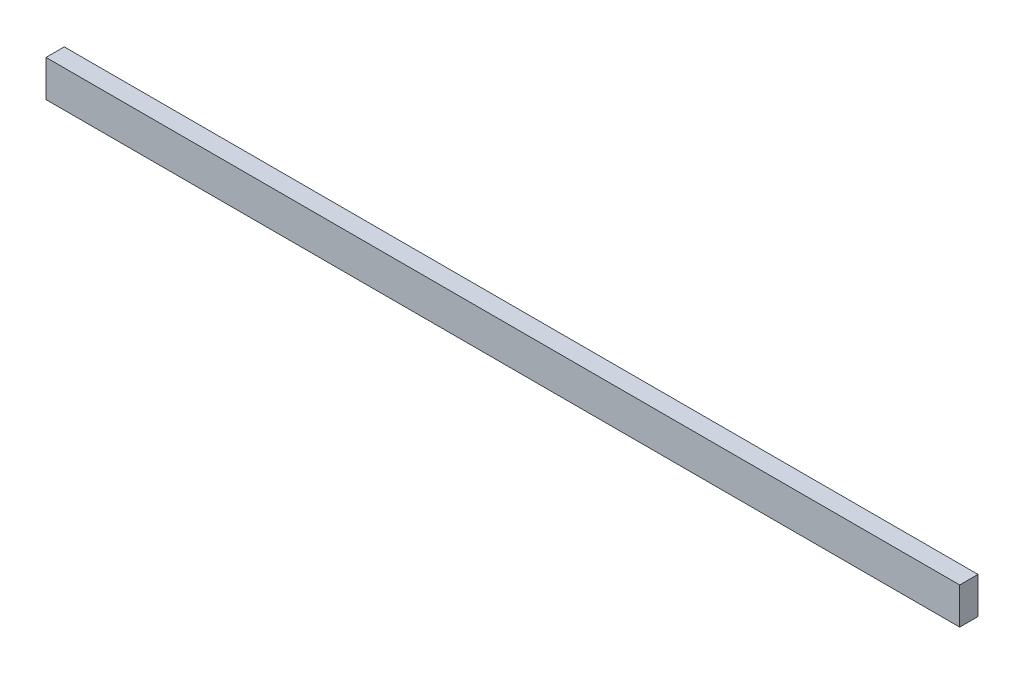
from build123d import *

# Parameters (mm, degrees)
SKETCH1_W           = 5000
SKETCH1_H           = 200
BOSS_EXTRUDE1_DEPTH = 100


with BuildPart() as part:
    # Sketch1 → Boss-Extrude1 (new body)
    with BuildSketch(Plane.XY):
        with Locations((2500, -100)):
            Rectangle(SKETCH1_W, SKETCH1_H)
    extrude(amount=BOSS_EXTRUDE1_DEPTH)


solid = part.part
